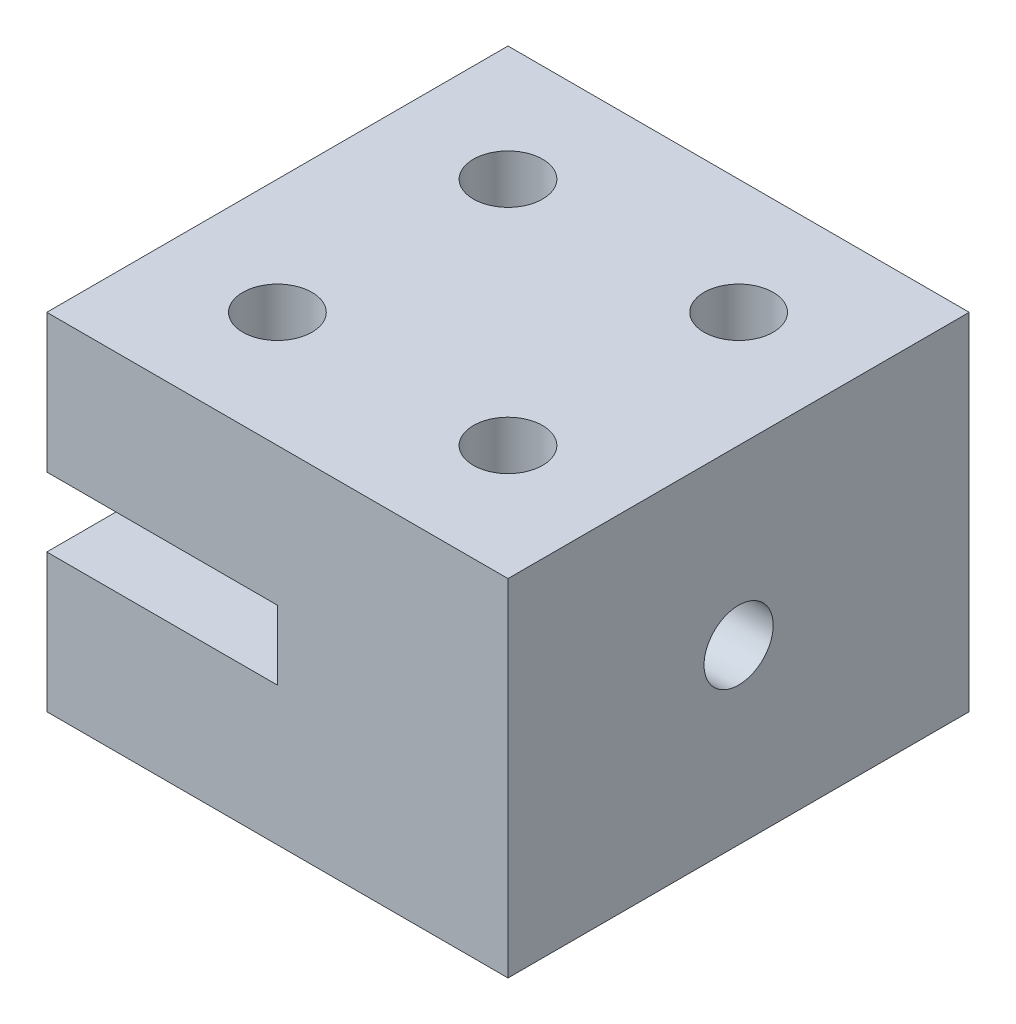
from build123d import *

# Parameters (mm, degrees)
SKETCH1_W            = 20
SKETCH1_H            = 20
BOSS_EXTRUDE1_DEPTH  = 7.5
SKETCH1_3_W          = 20
SKETCH1_3_H          = 20
CUT_EXTRUDE2_DEPTH   = 1.5
SKETCH3_W            = 10
SKETCH3_H            = 20
BOSS_EXTRUDE2_DEPTH  = 1.5
SKETCH4_R            = 1.5
CUT_EXTRUDE3_DEPTH   = 5
MOUNTHOLE_DEPTH      = 17.007810594
MOUNTHOLE_DEPTH_BACK = 17.007810594
SKETCH5_R            = 1.5
SKETCH6_R            = 3
CUT_EXTRUDE5_DEPTH   = 1.25


with BuildPart() as part:
    # Sketch1 → Boss-Extrude1 (new, symmetric)
    with BuildSketch(Plane(origin=(0, 0, 0), x_dir=(1, 0, 0), z_dir=(0, 1, 0))):
        Rectangle(SKETCH1_W, SKETCH1_H)
    extrude(amount=BOSS_EXTRUDE1_DEPTH, both=True)

    # Sketch1<3> → Cut-Extrude2 (cut, symmetric)
    with BuildSketch(Plane(origin=(0, 0, 0), x_dir=(1, 0, 0), z_dir=(0, 1, 0))):
        Rectangle(SKETCH1_3_W, SKETCH1_3_H)
    extrude(amount=CUT_EXTRUDE2_DEPTH, both=True, mode=Mode.SUBTRACT)


with BuildPart() as cut_extrude2_piece_1:
    # of the separate pieces the step leaves, piece 1, a body of its own (cut_extrude2_pieces)
    add(part.part.solids().sort_by_distance((-10, -7.5, -10))[0])



with BuildPart() as cut_extrude2_piece_2:
    # of the separate pieces the step leaves, piece 2, a body of its own (cut_extrude2_pieces)
    add(part.part.solids().sort_by_distance((-10, 1.5, -10))[0])


with BuildPart() as cut_extrude2_piece_1_1:
    add(cut_extrude2_piece_1.part)

    add(cut_extrude2_piece_2.part)  # Boss-Extrude2 merges Cut-Extrude2 piece 2
    # Sketch3 → Boss-Extrude2 (add, symmetric)
    with BuildSketch(Plane(origin=(0, 0, 0), x_dir=(1, 0, 0), z_dir=(0, 1, 0))):
        with Locations((5, 0)):
            Rectangle(SKETCH3_W, SKETCH3_H)
    extrude(amount=BOSS_EXTRUDE2_DEPTH, both=True)

    # Sketch4 → Cut-Extrude3 (cut)
    with BuildSketch(Plane(origin=(10, 0, 0), x_dir=(0, 0, -1), z_dir=(1, 0, 0))):
        Circle(SKETCH4_R)
    extrude(amount=-CUT_EXTRUDE3_DEPTH, mode=Mode.SUBTRACT)

    # Sketch5 → mounthole (cut, two sides: drawn at the far end of the back side and taken through both)
    with BuildSketch(Plane(origin=(0, 0, 0), x_dir=(1, 0, 0), z_dir=(0, 1, 0)).offset(-MOUNTHOLE_DEPTH_BACK)):
        with Locations((-5, 5)):
            Circle(SKETCH5_R)
        with Locations((5, 5)):
            Circle(SKETCH5_R)
        with Locations((5, -5)):
            Circle(SKETCH5_R)
        with Locations((-5, -5)):
            Circle(SKETCH5_R)
    extrude(amount=MOUNTHOLE_DEPTH + MOUNTHOLE_DEPTH_BACK, mode=Mode.SUBTRACT)

    # Sketch6 → Cut-Extrude5 (cut, symmetric)
    with BuildSketch(Plane(origin=(5, 0, 0), x_dir=(0, 0, -1), z_dir=(1, 0, 0))):
        Circle(SKETCH6_R)
    extrude(amount=CUT_EXTRUDE5_DEPTH, both=True, mode=Mode.SUBTRACT)


solid = cut_extrude2_piece_1_1.part
